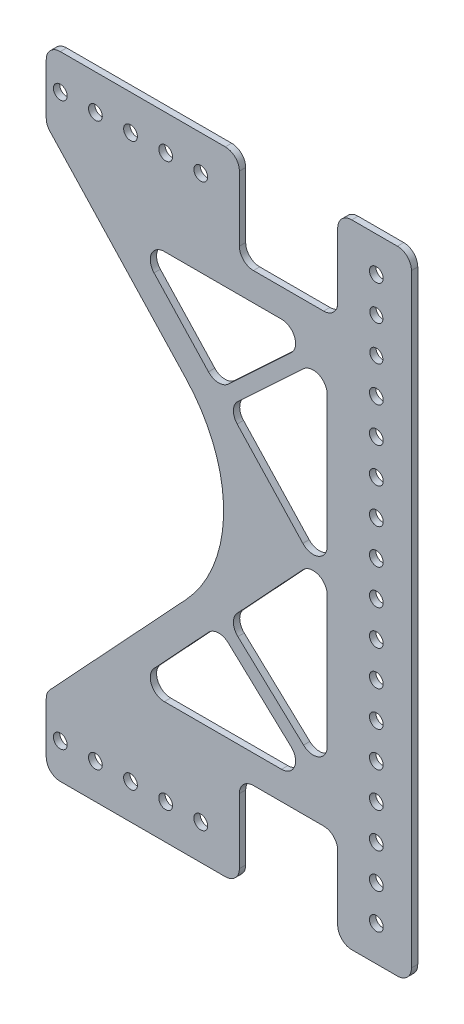
from build123d import *

# Parameters (mm, degrees)
SKETCH1_R           = 2.4892
SKETCH1_R_2         = 2.37186857
BOSS_EXTRUDE2_DEPTH = 2.286


with BuildPart() as part:
    # Sketch1 → Boss-Extrude2 (new body)
    with BuildSketch(Plane.XY):
        with BuildLine():
            Line((65.40759274, 898.497727162), (48.89759274, 898.497727162))
            ThreePointArc((48.89759274, 898.497727162), (45.305490291, 897.009829611), (43.81759274, 893.417727162))
            Line((43.81759274, 893.417727162), (43.81759274, 869.922727162))
            ThreePointArc((43.81759274, 869.922727162), (42.329695188, 866.330624714), (38.73759274, 864.842727162))
            Line((38.73759274, 864.842727162), (13.33759274, 864.842727162))
            ThreePointArc((13.33759274, 864.842727162), (9.745490291, 866.330624714), (8.25759274, 869.922727162))
            Line((8.25759274, 869.922727162), (8.25759274, 893.417727162))
            ThreePointArc((8.25759274, 893.417727162), (6.769695188, 897.009829611), (3.17759274, 898.497727162))
            Line((3.17759274, 898.497727162), (-56.51240726, 898.497727162))
            ThreePointArc((-56.51240726, 898.497727162), (-60.104509709, 897.009829611), (-61.59240726, 893.417727162))
            Line((-61.59240726, 893.417727162), (-61.59240726, 875.096507696))
            ThreePointArc((-61.59240726, 875.096507696), (-61.239653123, 873.236522064), (-60.230381059, 871.634850458))
            Line((-60.230381059, 871.634850458), (-11.051271068, 818.81429954))
            ThreePointArc((-11.051271068, 818.81429954), (2.568990945, 784.197727162), (-11.051271068, 749.581154784))
            Line((-11.051271068, 749.581154784), (-60.230381059, 696.760603866))
            ThreePointArc((-60.230381059, 696.760603866), (-61.239653123, 695.15893226), (-61.59240726, 693.298946628))
            Line((-61.59240726, 693.298946628), (-61.59240726, 674.977727162))
            ThreePointArc((-61.59240726, 674.977727162), (-60.104509709, 671.385624714), (-56.51240726, 669.897727162))
            Line((-56.51240726, 669.897727162), (3.17759274, 669.897727162))
            ThreePointArc((3.17759274, 669.897727162), (6.769695188, 671.385624714), (8.25759274, 674.977727162))
            Line((8.25759274, 674.977727162), (8.25759274, 698.472727162))
            ThreePointArc((8.25759274, 698.472727162), (9.745490291, 702.064829611), (13.33759274, 703.552727162))
            Line((13.33759274, 703.552727162), (38.73759274, 703.552727162))
            ThreePointArc((38.73759274, 703.552727162), (42.329695188, 702.064829611), (43.81759274, 698.472727162))
            Line((43.81759274, 698.472727162), (43.81759274, 674.977727162))
            ThreePointArc((43.81759274, 674.977727162), (45.305490291, 671.385624714), (48.89759274, 669.897727162))
            Line((48.89759274, 669.897727162), (65.40759274, 669.897727162))
            ThreePointArc((65.40759274, 669.897727162), (68.999695188, 671.385624714), (70.48759274, 674.977727162))
            Line((70.48759274, 674.977727162), (70.48759274, 784.197727162))
            Line((70.48759274, 784.197727162), (70.48759274, 893.417727162))
            ThreePointArc((70.48759274, 893.417727162), (68.999695188, 897.009829611), (65.40759274, 898.497727162))
        make_face()
        with Locations((-31.11240726, 885.797727162)):
            Circle(SKETCH1_R, mode=Mode.SUBTRACT)
        with Locations((-18.41240726, 885.797727162)):
            Circle(SKETCH1_R, mode=Mode.SUBTRACT)
        with Locations((-5.71240726, 885.797727162)):
            Circle(SKETCH1_R, mode=Mode.SUBTRACT)
        with Locations((57.78759274, 860.397727162)):
            Circle(SKETCH1_R_2, mode=Mode.SUBTRACT)
        with Locations((57.78759274, 847.697727162)):
            Circle(SKETCH1_R, mode=Mode.SUBTRACT)
        with Locations((57.78759274, 834.997727162)):
            Circle(SKETCH1_R, mode=Mode.SUBTRACT)
        with Locations((57.78759274, 822.297727162)):
            Circle(SKETCH1_R, mode=Mode.SUBTRACT)
        with Locations((57.78759274, 809.597727162)):
            Circle(SKETCH1_R, mode=Mode.SUBTRACT)
        with Locations((-5.71240726, 682.597727162)):
            Circle(SKETCH1_R, mode=Mode.SUBTRACT)
        with Locations((-18.41240726, 682.597727162)):
            Circle(SKETCH1_R, mode=Mode.SUBTRACT)
        with Locations((-31.11240726, 682.597727162)):
            Circle(SKETCH1_R, mode=Mode.SUBTRACT)
        with Locations((57.78759274, 733.397727162)):
            Circle(SKETCH1_R, mode=Mode.SUBTRACT)
        with Locations((57.78759274, 720.697727162)):
            Circle(SKETCH1_R, mode=Mode.SUBTRACT)
        with Locations((57.78759274, 707.997727162)):
            Circle(SKETCH1_R, mode=Mode.SUBTRACT)
        with Locations((57.78759274, 682.597727162)):
            Circle(SKETCH1_R, mode=Mode.SUBTRACT)
        with Locations((57.78759274, 885.797727162)):
            Circle(SKETCH1_R, mode=Mode.SUBTRACT)
        with Locations((57.78759274, 771.497727162)):
            Circle(SKETCH1_R, mode=Mode.SUBTRACT)
        with Locations((57.78759274, 758.797727162)):
            Circle(SKETCH1_R, mode=Mode.SUBTRACT)
        with Locations((57.78759274, 746.097727162)):
            Circle(SKETCH1_R, mode=Mode.SUBTRACT)
        with Locations((-56.51240726, 885.797727162)):
            Circle(SKETCH1_R, mode=Mode.SUBTRACT)
        with Locations((-43.81240726, 885.797727162)):
            Circle(SKETCH1_R, mode=Mode.SUBTRACT)
        with Locations((-43.81240726, 682.597727162)):
            Circle(SKETCH1_R, mode=Mode.SUBTRACT)
        with Locations((-56.51240726, 682.597727162)):
            Circle(SKETCH1_R, mode=Mode.SUBTRACT)
        with Locations((57.78759274, 796.897727162)):
            Circle(SKETCH1_R, mode=Mode.SUBTRACT)
        with Locations((57.78759274, 784.197727162)):
            Circle(SKETCH1_R, mode=Mode.SUBTRACT)
        with Locations((57.78759274, 873.097727162)):
            Circle(SKETCH1_R_2, mode=Mode.SUBTRACT)
        with Locations((57.78759274, 695.297727162)):
            Circle(SKETCH1_R, mode=Mode.SUBTRACT)
        with BuildLine():
            Line((-22.612168162, 846.141069924), (-2.925323721, 824.996523604))
            ThreePointArc((-2.925323721, 824.996523604), (0.611406899, 823.381415049), (4.254307315, 824.740207043))
            Line((4.254307315, 824.740207043), (26.964490273, 845.884753363))
            ThreePointArc((26.964490273, 845.884753363), (28.230078898, 851.462712794), (23.502833035, 854.682727162))
            Line((23.502833035, 854.682727162), (-18.894194364, 854.682727162))
            ThreePointArc((-18.894194364, 854.682727162), (-23.552070423, 851.630186315), (-22.612168162, 846.141069924))
        make_face(mode=Mode.SUBTRACT)
        with BuildLine():
            Line((40.00759274, 791.795734585), (40.00759274, 839.416910928))
            ThreePointArc((40.00759274, 839.416910928), (36.955051892, 844.074786987), (31.465935502, 843.134884727))
            Line((31.465935502, 843.134884727), (7.715964553, 821.022233244))
            ThreePointArc((7.715964553, 821.022233244), (6.100855998, 817.485502624), (7.459647992, 813.842602208))
            Line((7.459647992, 813.842602208), (31.209618941, 788.334077347))
            ThreePointArc((31.209618941, 788.334077347), (36.787578372, 787.068488722), (40.00759274, 791.795734585))
        make_face(mode=Mode.SUBTRACT)
        with BuildLine():
            Line((7.459647992, 754.552852117), (31.209618941, 780.061376977))
            ThreePointArc((31.209618941, 780.061376977), (36.787578372, 781.326965602), (40.00759274, 776.599719739))
            Line((40.00759274, 776.599719739), (40.00759274, 728.978543396))
            ThreePointArc((40.00759274, 728.978543396), (36.955051892, 724.320667337), (31.465935502, 725.260569598))
            Line((31.465935502, 725.260569598), (7.715964553, 747.37322108))
            ThreePointArc((7.715964553, 747.37322108), (6.100855998, 750.909951701), (7.459647992, 754.552852117))
        make_face(mode=Mode.SUBTRACT)
        with BuildLine():
            Line((26.964490273, 722.510700961), (4.254307315, 743.655247282))
            ThreePointArc((4.254307315, 743.655247282), (0.611406899, 745.014039275), (-2.925323721, 743.398930721))
            Line((-2.925323721, 743.398930721), (-22.612168162, 722.2543844))
            ThreePointArc((-22.612168162, 722.2543844), (-23.552070423, 716.765268009), (-18.894194364, 713.712727162))
            Line((-18.894194364, 713.712727162), (23.502833035, 713.712727162))
            ThreePointArc((23.502833035, 713.712727162), (28.230078898, 716.93274153), (26.964490273, 722.510700961))
        make_face(mode=Mode.SUBTRACT)
    extrude(amount=BOSS_EXTRUDE2_DEPTH)


solid = part.part
